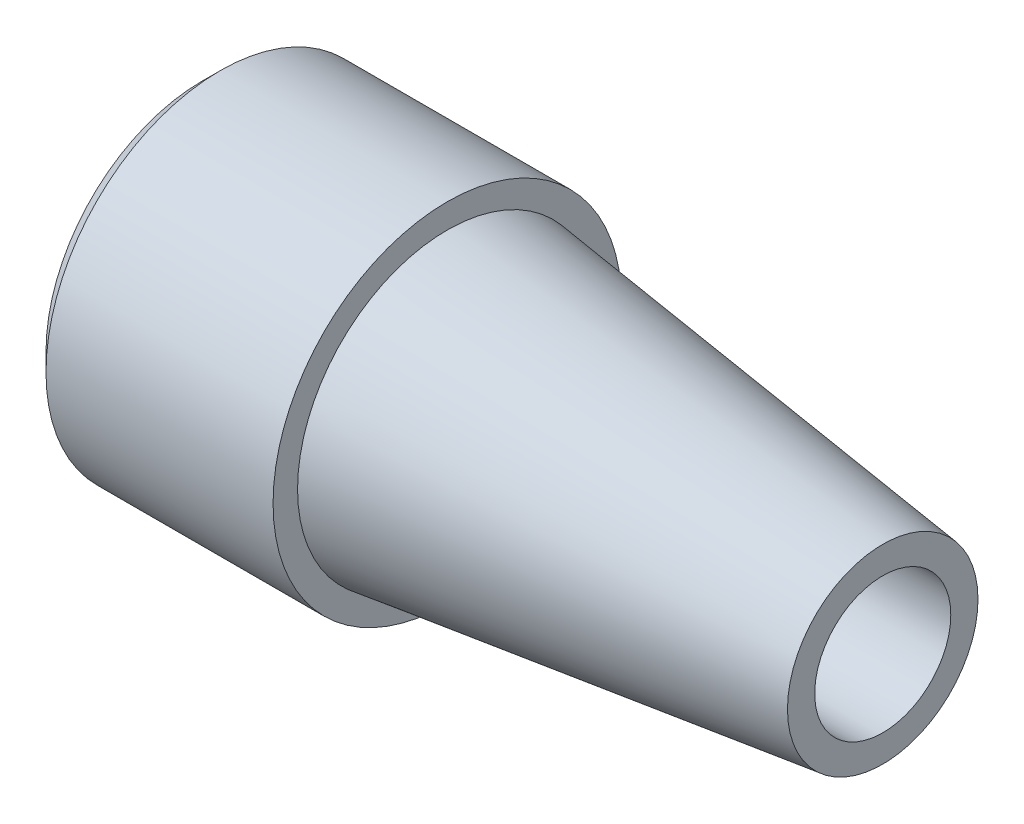
from build123d import *

# Parameters (mm, degrees)
EXTRUDE_START   = -45
SKETCH_4_R      = 32
SKETCH_4_R_2    = 27.5
EXTRUDE_1_DEPTH = 45
CHAMFER_1_SIZE  = 3.2875


with BuildPart() as part:
    # Эскиз1 → Повернуть1 (revolve)
    with BuildSketch(Plane.XY, mode=Mode.PRIVATE) as revolve_1_sk:
        Polygon((-125, 27.5), (-80, 27.5), (0, 17.5), (0, 12.5), (-77.272727273, 12.5), (-125, 25), align=None)
    revolve(revolve_1_sk.sketch.rotate(Axis((0, 0, 0), (-1, 0, 0)), 90), axis=Axis((0, 0, 0), (-1, 0, 0)))

    # Эскиз4 → Бобышка-Вытянуть1 (add)
    with BuildSketch(Plane.ZY.offset(125).offset(EXTRUDE_START)):
        Circle(SKETCH_4_R)
        Circle(SKETCH_4_R_2, mode=Mode.SUBTRACT)
    extrude(amount=EXTRUDE_1_DEPTH)

    # Фаска1
    chamfer_1_edges = [part.edges().sort_by_distance(p)[0] for p in [
        (-125, 0, -32),
    ]]
    chamfer(chamfer_1_edges, length=CHAMFER_1_SIZE)


solid = part.part
